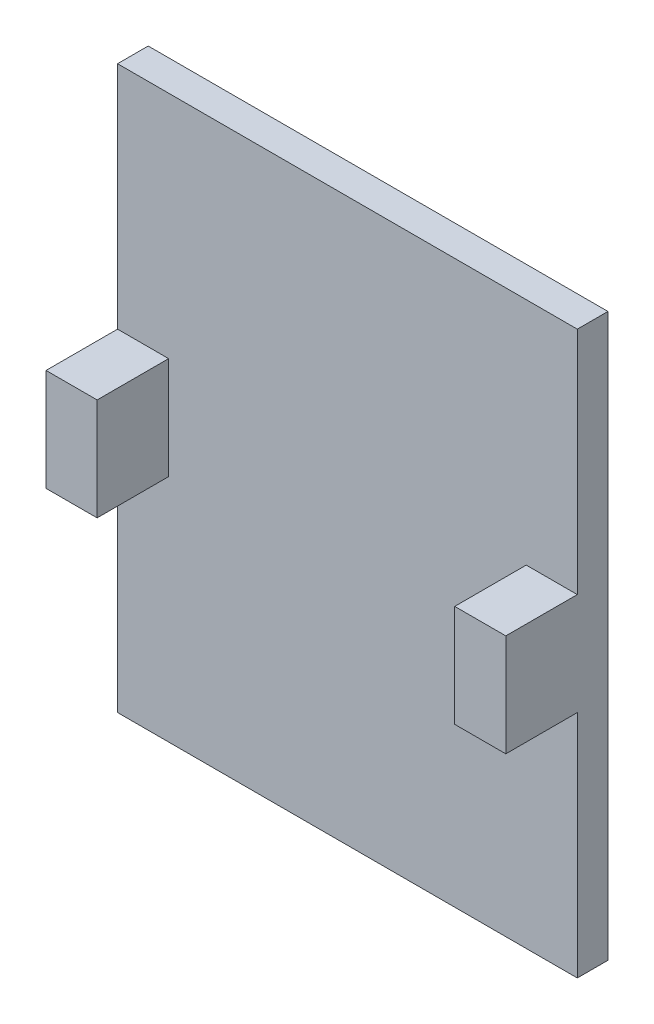
from build123d import *

# Parameters (mm, degrees)
SKETCH1_W           = 45000
SKETCH1_H           = 55000
BOSS_EXTRUDE1_DEPTH = 3000
SKETCH3_W           = 5000
SKETCH3_H           = 10000
BOSS_EXTRUDE2_DEPTH = 10000


with BuildPart() as part:
    # Sketch1 → Boss-Extrude1 (new body)
    with BuildSketch(Plane.XY):
        Rectangle(SKETCH1_W, SKETCH1_H)
    extrude(amount=BOSS_EXTRUDE1_DEPTH)

    # Sketch3 → Boss-Extrude2 (add)
    with BuildSketch(Plane.XY):
        with Locations((-20000, 0)):
            Rectangle(SKETCH3_W, SKETCH3_H)
        with Locations((20000, 0)):
            Rectangle(SKETCH3_W, SKETCH3_H)
    extrude(amount=BOSS_EXTRUDE2_DEPTH)


solid = part.part
